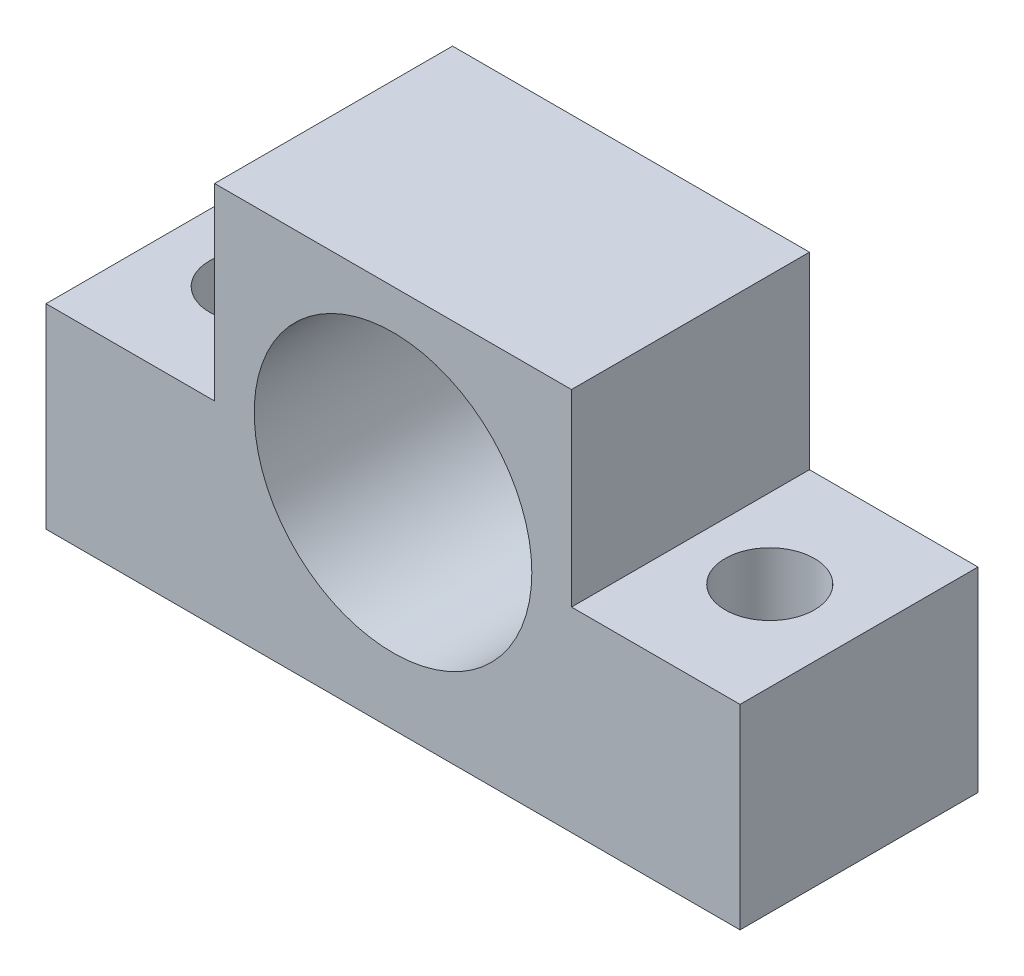
from build123d import *

# Parameters (mm, degrees)
ESBO_O1_R                = 14
RESSALTO_EXTRUS_O3_DEPTH = 24
SKETCH2_R                = 4.5
CUT_EXTRUDE1_DEPTH       = 47.787712062


with BuildPart() as part:
    # Esboço1 → Ressalto-extrusão3 (new body)
    with BuildSketch(Plane.XY):
        Polygon((-35, 0), (35, 0), (35, 19.7), (18, 19.7), (18, 38.7), (-18, 38.7), (-18, 19.7), (-35, 19.7), align=None)
        with Locations((0, 20.7)):
            Circle(ESBO_O1_R, mode=Mode.SUBTRACT)
    extrude(amount=RESSALTO_EXTRUS_O3_DEPTH)

    # Sketch2 → Cut-Extrude1 (cut, through all)
    with BuildSketch(Plane(origin=(0, 19.7, 0), x_dir=(1, 0, 0), z_dir=(0, 1, 0))):
        with Locations(Location((-26, -12, 0), (0, 0, 180))):
            Circle(SKETCH2_R)
        with Locations((26, -12)):
            Circle(SKETCH2_R)
    extrude(amount=-CUT_EXTRUDE1_DEPTH, mode=Mode.SUBTRACT)


solid = part.part
